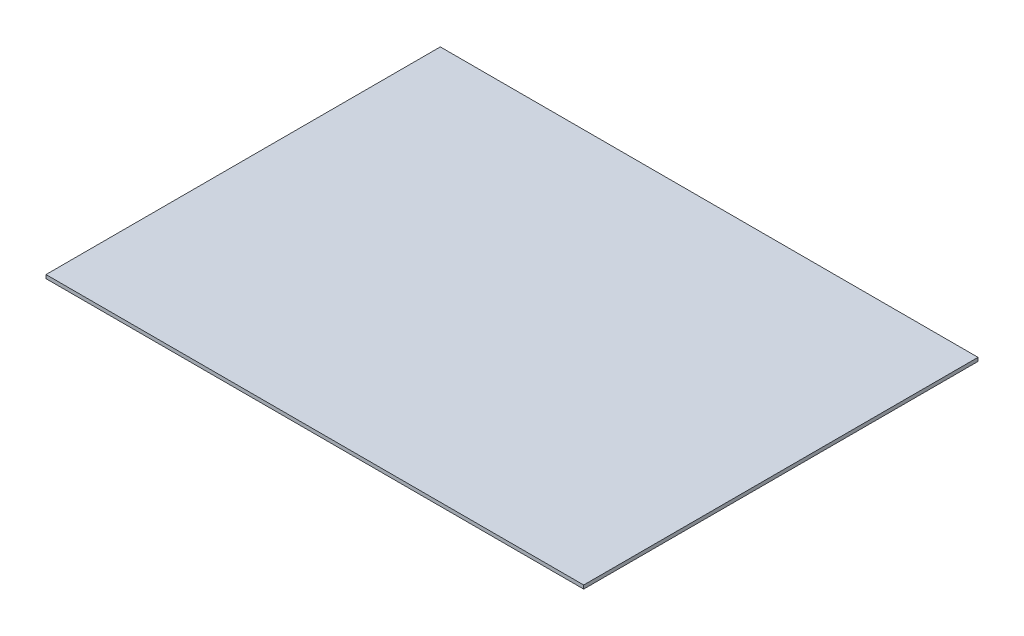
from build123d import *

# Parameters (mm, degrees)
SKETCH1_W           = 300
SKETCH1_H           = 220
BOSS_EXTRUDE1_DEPTH = 2


with BuildPart() as part:
    # Sketch1 → Boss-Extrude1 (new body)
    with BuildSketch(Plane(origin=(0, 0, 0), x_dir=(1, 0, 0), z_dir=(0, 1, 0))):
        Rectangle(SKETCH1_W, SKETCH1_H)
    extrude(amount=BOSS_EXTRUDE1_DEPTH)


solid = part.part
